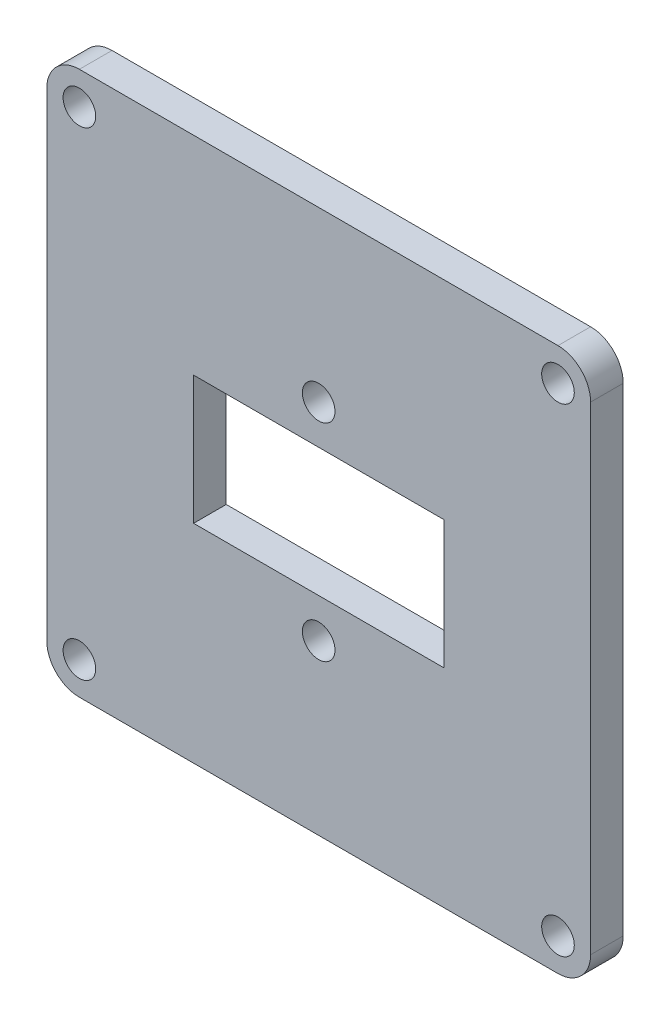
from build123d import *

# Parameters (mm, degrees)
ESQUISSE14_R        = 1.5
ESQUISSE14_W        = 23
ESQUISSE14_H        = 11.8
BOSS_EXTRU_14_DEPTH = 3


with BuildPart() as part:
    # Esquisse14 → Boss.-Extru.14 (new body)
    with BuildSketch(Plane.XY):
        with BuildLine():
            Line((25.187621145, -60.61533349), (69.187621145, -60.61533349))
            ThreePointArc((69.187621145, -60.61533349), (71.308941488, -61.494013147), (72.187621145, -63.61533349))
            Line((72.187621145, -63.61533349), (72.187621145, -107.61533349))
            ThreePointArc((72.187621145, -107.61533349), (71.308941488, -109.736653834), (69.187621145, -110.61533349))
            Line((69.187621145, -110.61533349), (25.187621145, -110.61533349))
            ThreePointArc((25.187621145, -110.61533349), (23.066300801, -109.736653834), (22.187621145, -107.61533349))
            Line((22.187621145, -107.61533349), (22.187621145, -63.61533349))
            ThreePointArc((22.187621145, -63.61533349), (23.066300801, -61.494013147), (25.187621145, -60.61533349))
        make_face()
        with Locations((47.187621145, -76.11533349)):
            Circle(ESQUISSE14_R, mode=Mode.SUBTRACT)
        with Locations((47.187621145, -95.11533349)):
            Circle(ESQUISSE14_R, mode=Mode.SUBTRACT)
        with Locations((25.187621145, -63.61533349)):
            Circle(ESQUISSE14_R, mode=Mode.SUBTRACT)
        with Locations((25.187621145, -107.61533349)):
            Circle(ESQUISSE14_R, mode=Mode.SUBTRACT)
        with Locations((69.187621145, -107.61533349)):
            Circle(ESQUISSE14_R, mode=Mode.SUBTRACT)
        with Locations((69.187621145, -63.61533349)):
            Circle(ESQUISSE14_R, mode=Mode.SUBTRACT)
        with Locations((47.187621145, -85.61533349)):
            Rectangle(ESQUISSE14_W, ESQUISSE14_H, mode=Mode.SUBTRACT)
    extrude(amount=BOSS_EXTRU_14_DEPTH)


solid = part.part
